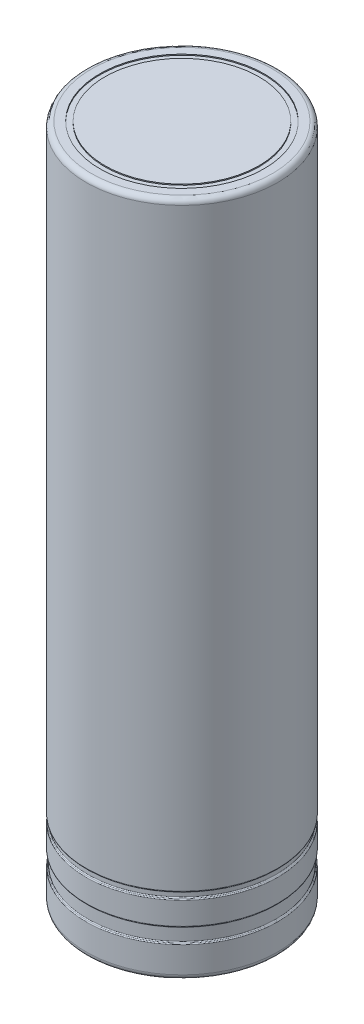
from build123d import *

# Parameters (mm, degrees)
BODY_MOVE_COPY1_ANGLE = 180


with BuildPart() as part:
    # Sketch1 → Revolve1 (revolve)
    with BuildSketch(Plane.XY):
        with BuildLine():
            Line((7.4, -32.4), (7.9, -32.4))
            Line((7.9, -32.4), (8.7, -32.4))
            ThreePointArc((8.7, -32.4), (8.982842712, -32.282842712), (9.1, -32))
            Line((9.1, -32), (9.1, 25.04))
            ThreePointArc((9.1, 25.04), (8.998754845, 25.112466245), (8.96, 25.23078784))
            Line((8.96, 25.23078784), (8.96, 25.60921216))
            ThreePointArc((8.96, 25.60921216), (8.998754845, 25.727533755), (9.1, 25.8))
            Line((9.1, 25.8), (9.1, 27.96))
            ThreePointArc((9.1, 27.96), (8.998754845, 28.032466245), (8.96, 28.15078784))
            Line((8.96, 28.15078784), (8.96, 29.30921216))
            ThreePointArc((8.96, 29.30921216), (8.998754845, 29.427533755), (9.1, 29.5))
            Line((9.1, 29.5), (9.1, 32))
            ThreePointArc((9.1, 32), (8.982842712, 32.282842712), (8.7, 32.4))
            Line((8.7, 32.4), (6.8, 32.4))
            Line((6.8, 32.4), (5.35, 32.4))
            Line((5.35, 32.4), (5.35, 31.9))
            Line((5.35, 31.9), (4.63, 31.9))
            Line((4.63, 31.9), (4.63, 32.2))
            ThreePointArc((4.63, 32.2), (4.542132034, 32.412132034), (4.33, 32.5))
            Line((4.33, 32.5), (0, 32.5))
            Line((0, 32.5), (0, -32.5))
            Line((0, -32.5), (7.4, -32.5))
            Line((7.4, -32.5), (7.4, -32.4))
        make_face()
    revolve(axis=Axis((0, -32.5, 0), (0, -1, 0)))


with BuildPart() as body_2:
    # Sketch1<3> → Revolve2 (revolve)
    with BuildSketch(Plane.XY):
        with BuildLine():
            Line((9.2, -32), (9.2, 25.04))
            ThreePointArc((9.2, 25.04), (9.180622577, 25.099160798), (9.13, 25.13539392))
            ThreePointArc((9.13, 25.13539392), (9.079377423, 25.171627042), (9.06, 25.23078784))
            Line((9.06, 25.23078784), (9.06, 25.60921216))
            ThreePointArc((9.06, 25.60921216), (9.079377423, 25.668372958), (9.13, 25.70460608))
            ThreePointArc((9.13, 25.70460608), (9.180622577, 25.740839202), (9.2, 25.8))
            Line((9.2, 25.8), (9.2, 27.96))
            ThreePointArc((9.2, 27.96), (9.180622577, 28.019160798), (9.13, 28.05539392))
            ThreePointArc((9.13, 28.05539392), (9.079377423, 28.091627042), (9.06, 28.15078784))
            Line((9.06, 28.15078784), (9.06, 29.30921216))
            ThreePointArc((9.06, 29.30921216), (9.079377423, 29.368372958), (9.13, 29.40460608))
            ThreePointArc((9.13, 29.40460608), (9.180622577, 29.440839202), (9.2, 29.5))
            Line((9.2, 29.5), (9.2, 32))
            ThreePointArc((9.2, 32), (9.053553391, 32.353553391), (8.7, 32.5))
            Line((8.7, 32.5), (6.8, 32.5))
            Line((6.8, 32.5), (6.8, 32.4))
            Line((6.8, 32.4), (8.7, 32.4))
            ThreePointArc((8.7, 32.4), (8.982842712, 32.282842712), (9.1, 32))
            Line((9.1, 32), (9.1, 29.5))
            ThreePointArc((9.1, 29.5), (8.998754845, 29.427533755), (8.96, 29.30921216))
            Line((8.96, 29.30921216), (8.96, 28.15078784))
            ThreePointArc((8.96, 28.15078784), (8.998754845, 28.032466245), (9.1, 27.96))
            Line((9.1, 27.96), (9.1, 25.8))
            ThreePointArc((9.1, 25.8), (8.998754845, 25.727533755), (8.96, 25.60921216))
            Line((8.96, 25.60921216), (8.96, 25.23078784))
            ThreePointArc((8.96, 25.23078784), (8.998754845, 25.112466245), (9.1, 25.04))
            Line((9.1, 25.04), (9.1, -32))
            ThreePointArc((9.1, -32), (8.982842712, -32.282842712), (8.7, -32.4))
            Line((8.7, -32.4), (7.9, -32.4))
            Line((7.9, -32.4), (7.9, -32.5))
            Line((7.9, -32.5), (8.7, -32.5))
            ThreePointArc((8.7, -32.5), (9.053553391, -32.353553391), (9.2, -32))
        make_face()
    revolve(axis=Axis((0, -32.5, 0), (0, -1, 0)))


with BuildPart() as part_1:
    # Body-Move/Copy1: moved
    add(part.part.rotate(Axis((0, 0, 0), (0, 0, 1)), BODY_MOVE_COPY1_ANGLE))


with BuildPart() as body_2_1:
    # Body-Move/Copy1: moved
    add(body_2.part.rotate(Axis((0, 0, 0), (0, 0, 1)), BODY_MOVE_COPY1_ANGLE))


solid = Compound([part_1.part, body_2_1.part])
